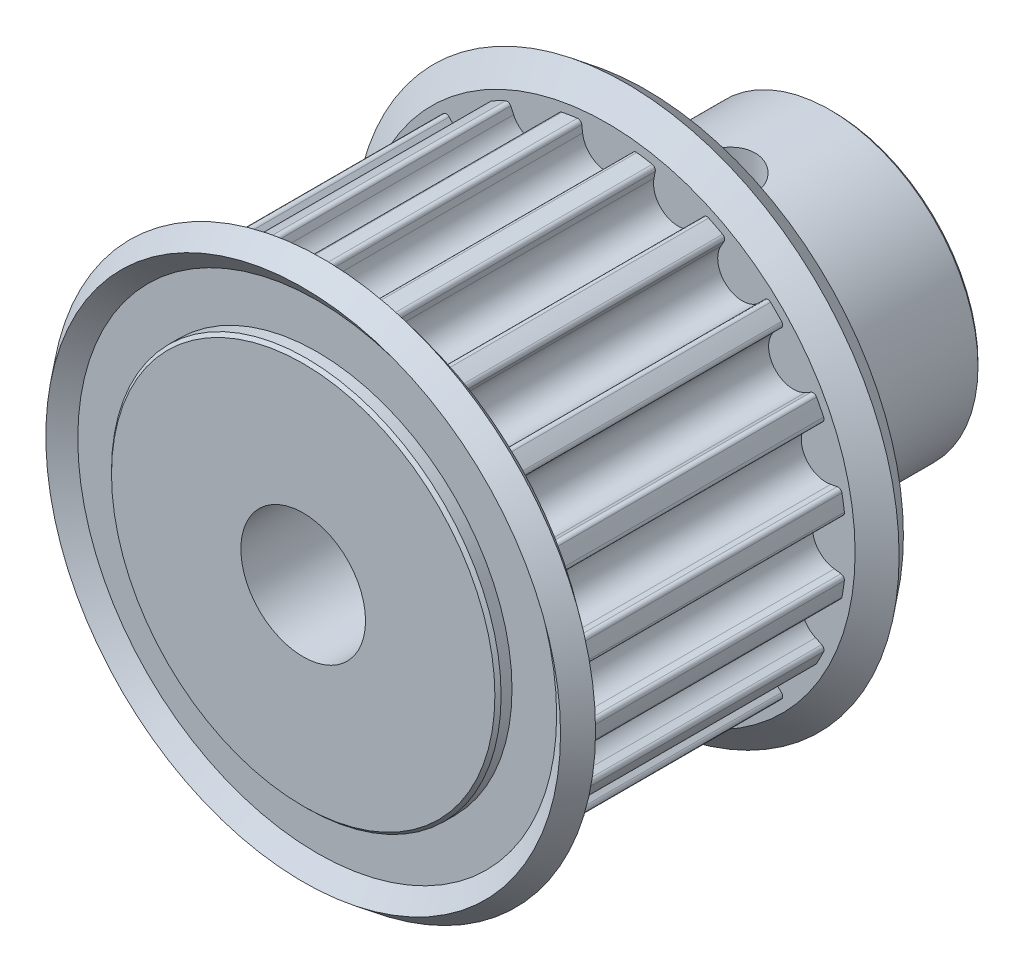
from build123d import *
from build123d.topology import SkipClean

# Parameters (mm, degrees)
CUT_EXTRUDE_START          = 8.5
CUT_EXTRUDE_1_DEPTH        = 17
PATTERN_CIRCULAR_1_COUNT   = 20
SKETCH_7_W                 = 12
SKETCH_7_H                 = 9.5
CUT_EXTRUDE_START_2        = -23
CUT_EXTRUDE_N_DEPTH        = 34
EXTRUDE_START              = -23
EXTRUDE_P_DEPTH            = 34
CUT_EXTRUDE_1_2_REACH      = 35.786
CUT_EXTRUDE_1_2_END_RADIUS = 9.5
SKETCH_8_R                 = 2
PATTERN_CIRCULAR_2_COUNT   = 2
PATTERN_CIRCULAR_2_ANGLE   = 120
CHAMFER_1_SIZE             = 0.2


with BuildPart() as part:
    # 草图3 → 旋转1 (revolve)
    with BuildSketch(Plane(origin=(0, 0, 0), x_dir=(0, 0, -1), z_dir=(1, 0, 0)), mode=Mode.PRIVATE) as revolve_1_sk:
        Polygon((-11, 12.5), (-11, 0), (11, 0), (11, 12.5), (10.1, 12.5), (10.1, 15.363593547), (11, 16.514262338), (9.739713818, 17.5), (8.5, 15.915), (8.5, 15.345), (-8.5, 15.345), (-8.5, 15.915), (-9.739713818, 17.5), (-11, 16.514262338), (-10.1, 15.363593547), (-10.1, 12.5), align=None)
    revolve(revolve_1_sk.sketch.rotate(Axis((0, 0, 34.781081475), (0, 0, -1)), 90), axis=Axis((0, 0, 34.781081475), (0, 0, -1)))

    # 草图4 → Cut-Extrude 1 (cut)
    with BuildSketch(Plane.XY.offset(CUT_EXTRUDE_START)):
        with BuildLine():
            Line((-1.571812751, 14.575622452), (-1.625, 15.008797834))
            ThreePointArc((-1.625, 15.008797834), (-1.719441663, 15.175505257), (-1.904159005, 15.226398244))
            ThreePointArc((-1.904159005, 15.226398244), (0, 15.345), (1.904159005, 15.226398244))
            ThreePointArc((1.904159005, 15.226398244), (1.719441663, 15.175505257), (1.625, 15.008797834))
            Line((1.625, 15.008797834), (1.571812751, 14.575622452))
            ThreePointArc((1.571812751, 14.575622452), (0, 13.185), (-1.571812751, 14.575622452))
        make_face()
    cut_extrude_1 = extrude(amount=-CUT_EXTRUDE_1_DEPTH, mode=Mode.SUBTRACT)

    # 阵列(圆周)1: Cut-Extrude 1 ×20 about axis
    pattern_circular_1_axis = Axis((0, 0, 0), (0, 0, 1))
    for i in range(1, PATTERN_CIRCULAR_1_COUNT):
        add(cut_extrude_1.rotate(pattern_circular_1_axis, i * 360 / PATTERN_CIRCULAR_1_COUNT), mode=Mode.SUBTRACT)

    # 草图7 → 旋转2 (revolve)
    with BuildSketch(Plane(origin=(0, 0, 0), x_dir=(0, 0, -1), z_dir=(1, 0, 0)), mode=Mode.PRIVATE) as revolve_2_sk:
        with Locations((17, 4.75)):
            Rectangle(SKETCH_7_W, SKETCH_7_H)
    revolve(revolve_2_sk.sketch.rotate(Axis((0, 0, 34.781081475), (0, 0, -1)), 90), axis=Axis((0, 0, 34.781081475), (0, 0, -1)))

    # 草图6 → N (cut)
    with BuildSketch(Plane.XY.offset(CUT_EXTRUDE_START_2)):
        with BuildLine():
            Line((-1.5, 5.4), (1.5, 5.4))
            Line((1.5, 5.4), (1.5, 3.708099244))
            ThreePointArc((1.5, 3.708099244), (0, -4), (-1.5, 3.708099244))
            Line((-1.5, 3.708099244), (-1.5, 5.4))
        make_face()
    extrude(amount=CUT_EXTRUDE_N_DEPTH, mode=Mode.SUBTRACT)

    # 草图9 → P (add)
    with SkipClean():  # the faces are left unmerged after this step: merging them gives an invalid solid
        with BuildSketch(Plane.XY.offset(EXTRUDE_START)):
            with BuildLine():
                Line((-1.5, 3.708099244), (-1.5, 5.4))
                Line((-1.5, 5.4), (1.5, 5.4))
                Line((1.5, 5.4), (1.5, 3.708099244))
                ThreePointArc((1.5, 3.708099244), (0, 4), (-1.5, 3.708099244))
            make_face()
        extrude(amount=EXTRUDE_P_DEPTH)

    # Cut-Extrude 1 2: up to this cylinder (the profile starts inside it)
    with SkipClean():  # the faces are left unmerged after this step: merging them gives an invalid solid
        cut_extrude_1_2_end = Plane(origin=(0, 0, -16), z_dir=(0, 0, 1)) * Cylinder(CUT_EXTRUDE_1_2_END_RADIUS, 91.572, mode=Mode.PRIVATE)
        # 草图8 → Cut-Extrude 1 2 (cut, up to the surface)
        with BuildSketch(Plane(origin=(0, 0, 0), x_dir=(1, 0, 0), z_dir=(0, 1, 0)), mode=Mode.PRIVATE) as cut_extrude_1_2_sk1:
            with Locations(Location((0, 16, 0), (0, 0, 90))):
                Circle(SKETCH_8_R)
        cut_extrude_1_2_tool1 = extrude(cut_extrude_1_2_sk1.sketch, amount=CUT_EXTRUDE_1_2_REACH, mode=Mode.PRIVATE) & cut_extrude_1_2_end
        cut_extrude_1_2 = cut_extrude_1_2_tool1.solids().sort_by_distance((0, 0, -16))[0]
        add(cut_extrude_1_2, mode=Mode.SUBTRACT)

    # 螺纹孔2: Cut-Extrude 1 2 ×2 about axis
    with SkipClean():  # the faces are left unmerged after this step: merging them gives an invalid solid
        pattern_circular_2_axis = Axis((0, 0, 34.781081475), (0, 0, 1))
        for i in range(1, PATTERN_CIRCULAR_2_COUNT):
            add(cut_extrude_1_2.rotate(pattern_circular_2_axis, i * PATTERN_CIRCULAR_2_ANGLE / (PATTERN_CIRCULAR_2_COUNT - 1)), mode=Mode.SUBTRACT)

    # 倒角1
    chamfer_1_edges = [part.edges().sort_by_distance(p)[0] for p in [
        (-12.5, 0, -11),
        (-12.5, 0, 11),
        (-9.5, 0, -23),
    ]]
    chamfer(chamfer_1_edges, length=CHAMFER_1_SIZE)


solid = part.part
